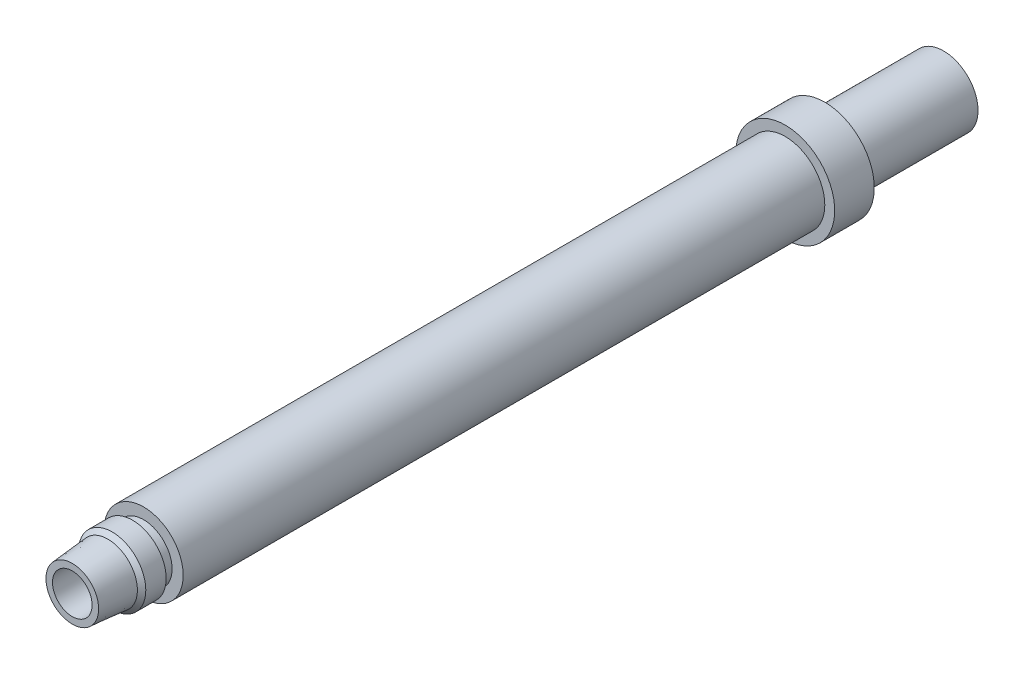
from build123d import *

# Parameters (mm, degrees)
SKETCH2_R           = 7.9375
SKETCH2_R_2         = 3.175
BOSS_EXTRUDE1_DEPTH = 139.7
SKETCH3_OUTSIDE_W   = 46.174
SKETCH3_OUTSIDE_H   = 46.174
SKETCH3_OUTSIDE_R   = 5.5245
CUT_EXTRUDE1_DEPTH  = 19.05
SKETCH4_OUTSIDE_W   = 46.174
SKETCH4_OUTSIDE_H   = 46.174
SKETCH4_OUTSIDE_R   = 6.35
CUT_EXTRUDE2_DEPTH  = 114.3


with BuildPart() as part:
    # Sketch2 → Boss-Extrude1 (new body)
    with BuildSketch(Plane.XY):
        Circle(SKETCH2_R)
        Circle(SKETCH2_R_2, mode=Mode.SUBTRACT)
    extrude(amount=BOSS_EXTRUDE1_DEPTH)

    # Sketch3 outside → Cut-Extrude1 (cut)
    with BuildSketch(Plane(origin=(0, 0, 0), x_dir=(-1, 0, 0), z_dir=(0, 0, -1))):
        Rectangle(SKETCH3_OUTSIDE_W, SKETCH3_OUTSIDE_H)
        Circle(SKETCH3_OUTSIDE_R, mode=Mode.SUBTRACT)
    extrude(amount=-CUT_EXTRUDE1_DEPTH, mode=Mode.SUBTRACT)

    # Sketch4 outside → Cut-Extrude2 (cut)
    with BuildSketch(Plane.XY.offset(139.7)):
        Rectangle(SKETCH4_OUTSIDE_W, SKETCH4_OUTSIDE_H)
        Circle(SKETCH4_OUTSIDE_R, mode=Mode.SUBTRACT)
    extrude(amount=-CUT_EXTRUDE2_DEPTH, mode=Mode.SUBTRACT)

    # Sketch9 → Cut-Revolve1 (revolve, cut)
    with BuildSketch(Plane(origin=(0, 0, 0), x_dir=(0, 0, -1), z_dir=(1, 0, 0)), mode=Mode.PRIVATE) as cut_revolve1_sk:
        Polygon((-133.985, 4.7244), (-139.7, 4.224402288), (-139.7, 6.35), (-128.27, 6.35), (-128.27, 4.572), (-130.048, 4.572), (-130.048, 5.3975), (-133.3119, 5.3975), align=None)
    revolve(cut_revolve1_sk.sketch.rotate(Axis((0, 0, 139.7), (0, 0, -1)), 90), axis=Axis((0, 0, 139.7), (0, 0, -1)), mode=Mode.SUBTRACT)


solid = part.part
